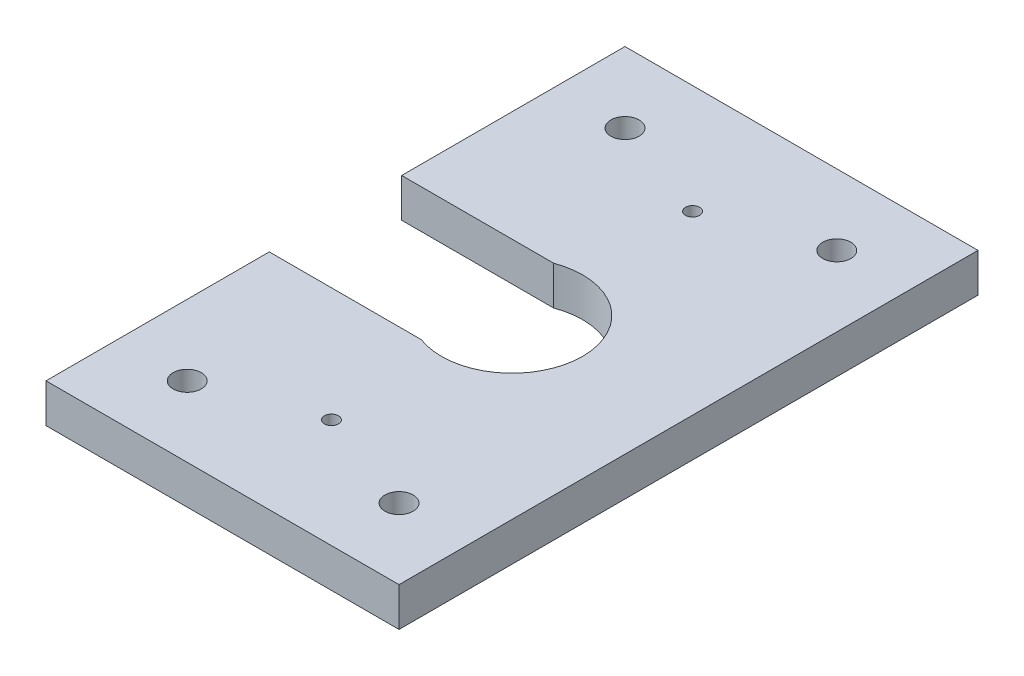
from build123d import *

# Parameters (mm, degrees)
SKETCH_1_R      = 0.8
SKETCH_1_R_2    = 0.4
EXTRUDE_1_DEPTH = 2.2


with BuildPart() as part:
    # 草图1 → 凸台-拉伸1 (new body)
    with BuildSketch(Plane(origin=(0, 0, 0), x_dir=(1, 0, 0), z_dir=(0, 1, 0))):
        with BuildLine():
            Line((20, 0), (0, 0))
            Line((0, 0), (0, -12.65))
            Line((0, -12.65), (8.608058909, -12.65))
            ThreePointArc((8.608058909, -12.65), (12.283882181, -13.116117819), (14, -16.4))
            ThreePointArc((14, -16.4), (12.283882181, -19.683882181), (8.608058909, -20.15))
            Line((8.608058909, -20.15), (0, -20.15))
            Line((0, -20.15), (0, -32.8))
            Line((0, -32.8), (20, -32.8))
            Line((20, -32.8), (20, 0))
        make_face()
        with Locations(Location((4, -28.8, 0), (0, 0, 270))):
            Circle(SKETCH_1_R, mode=Mode.SUBTRACT)
        with Locations(Location((10, -26.63, 0), (0, 0, 270))):
            Circle(SKETCH_1_R_2, mode=Mode.SUBTRACT)
        with Locations(Location((16, -28.8, 0), (0, 0, 270))):
            Circle(SKETCH_1_R, mode=Mode.SUBTRACT)
        with Locations(Location((4, -4, 0), (0, 0, 270))):
            Circle(SKETCH_1_R, mode=Mode.SUBTRACT)
        with Locations(Location((10, -6.17, 0), (0, 0, 270))):
            Circle(SKETCH_1_R_2, mode=Mode.SUBTRACT)
        with Locations(Location((16, -4, 0), (0, 0, 270))):
            Circle(SKETCH_1_R, mode=Mode.SUBTRACT)
    extrude(amount=EXTRUDE_1_DEPTH)


solid = part.part
